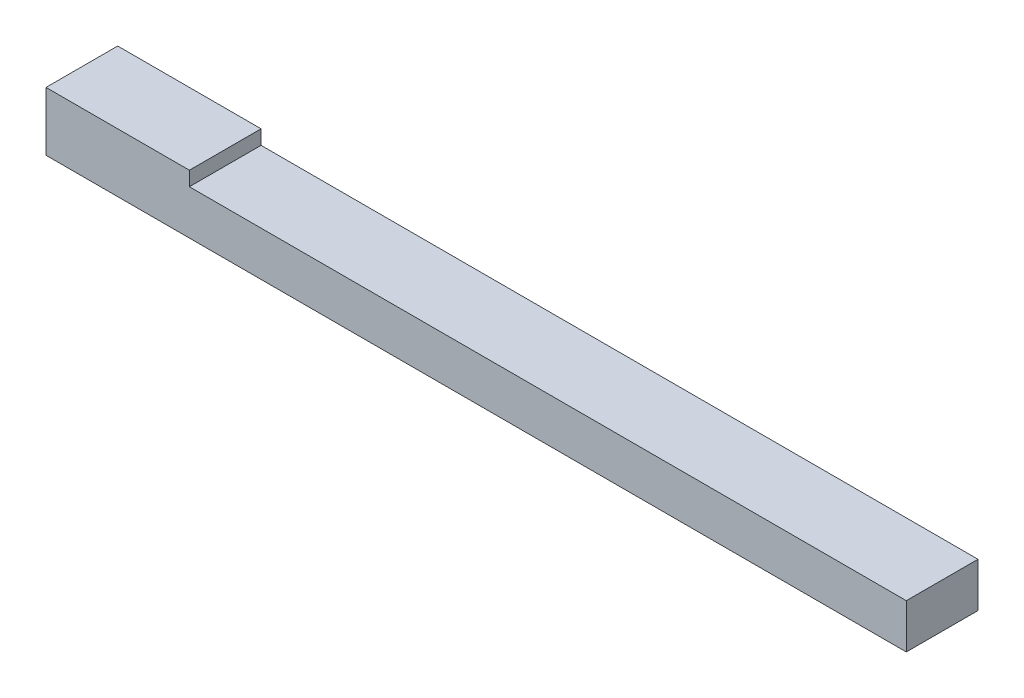
from build123d import *

# Parameters (mm, degrees)
SKETCH_1_W      = 120
SKETCH_1_H      = 10
EXTRUDE_1_DEPTH = 6.2
SKETCH_5_W      = 20
SKETCH_5_H      = 10
EXTRUDE_3_DEPTH = 2


with BuildPart() as part:
    # 草图1 → 凸台-拉伸1 (new body)
    with BuildSketch(Plane(origin=(0, 0, 0), x_dir=(1, 0, 0), z_dir=(0, 1, 0))):
        with Locations((-60, 5)):
            Rectangle(SKETCH_1_W, SKETCH_1_H)
    extrude(amount=EXTRUDE_1_DEPTH)

    # 草图5 → 凸台-拉伸3 (add)
    with BuildSketch(Plane(origin=(0, 6.2, 0), x_dir=(1, 0, 0), z_dir=(0, 1, 0))):
        with Locations((-110, 5)):
            Rectangle(SKETCH_5_W, SKETCH_5_H)
    extrude(amount=EXTRUDE_3_DEPTH)


solid = part.part
